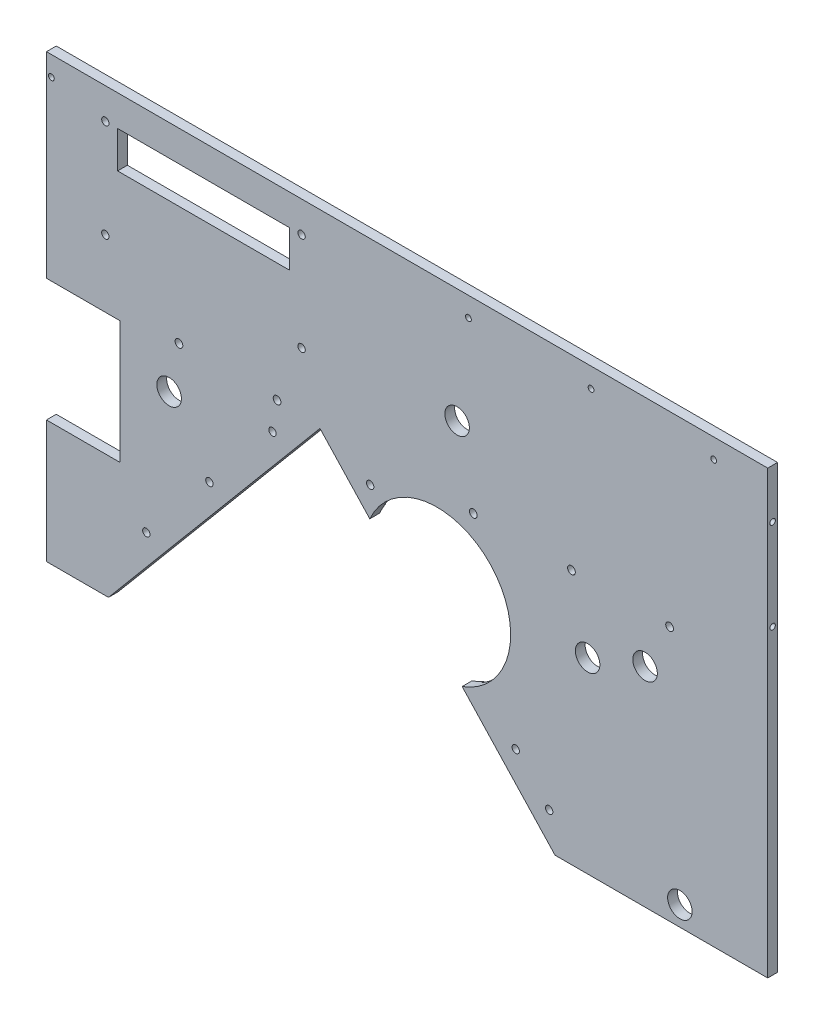
from build123d import *

# Parameters (mm, degrees)
BOSS_EXTRUDE1_DEPTH = 5.08
CUT_EXTRUDE2_DEPTH  = 1.27
SKETCH5_W           = 38.1
SKETCH5_H           = 63.5
CUT_EXTRUDE3_DEPTH  = 7.62
SKETCH6_R           = 1.905
CUT_EXTRUDE4_DEPTH  = 7.62
SKETCH7_R           = 38.1
CUT_EXTRUDE5_DEPTH  = 7.62
SKETCH8_R           = 1.905
SKETCH8_W           = 88.9
SKETCH8_H           = 19.05
CUT_EXTRUDE6_DEPTH  = 7.62
SKETCH9_R           = 6.35
CUT_EXTRUDE7_DEPTH  = 7.62
SKETCH10_R          = 6.35
CUT_EXTRUDE8_DEPTH  = 7.62
SKETCH11_R          = 1.5
CUT_EXTRUDE9_DEPTH  = 25.4
SKETCH12_R          = 2
CUT_EXTRUDE10_DEPTH = 381
SKETCH13_R          = 1.4224
CUT_EXTRUDE11_DEPTH = 12.7


with BuildPart() as part:
    # Sketch2 → Boss-Extrude1 (new body)
    with BuildSketch(Plane.XY):
        Polygon((0, 0), (32.101676515, 0), (141.594783791, 130.488803961), (263.277562057, 0), (373.38, 0), (373.38, 228.6), (0, 228.6), align=None)
    extrude(amount=BOSS_EXTRUDE1_DEPTH)

    # Sketch4 → Cut-Extrude2 (cut)
    with BuildSketch(Plane(origin=(0, 0, 0), x_dir=(-1, 0, 0), z_dir=(0, 0, -1))):
        Polygon((-283.710082919, 0), (-271.867141325, 0), (-141.594783791, 139.7), (-24.372565316, 0), (-13.716, 0), (-141.594783791, 152.4), align=None)
    extrude(amount=-CUT_EXTRUDE2_DEPTH, mode=Mode.SUBTRACT)

    # Sketch5 → Cut-Extrude3 (cut)
    with BuildSketch(Plane.XY.offset(5.08)):
        with Locations((19.05, 95.25)):
            Rectangle(SKETCH5_W, SKETCH5_H)
    extrude(amount=-CUT_EXTRUDE3_DEPTH, mode=Mode.SUBTRACT)

    # Sketch6 → Cut-Extrude4 (cut)
    with BuildSketch(Plane(origin=(0, 0, 1.27), x_dir=(-1, 0, 0), z_dir=(0, 0, -1))):
        with Locations((-51.69789323, 38.91505771)):
            Circle(SKETCH6_R)
        with Locations((-84.351503802, 77.830115421)):
            Circle(SKETCH6_R)
        with Locations((-117.005114374, 116.745173131)):
            Circle(SKETCH6_R)
        with Locations((-167.57892131, 118.185423968)):
            Circle(SKETCH6_R)
        with Locations((-242.932920113, 37.378153476)):
            Circle(SKETCH6_R)
        with Locations((-260.255678459, 18.801769455)):
            Circle(SKETCH6_R)
    extrude(amount=-CUT_EXTRUDE4_DEPTH, mode=Mode.SUBTRACT)

    # Sketch7 → Cut-Extrude5 (cut)
    with BuildSketch(Plane(origin=(0, 0, 0), x_dir=(-1, 0, 0), z_dir=(0, 0, -1))):
        with Locations((-202.206417984, 87.401980028)):
            Circle(SKETCH7_R)
    extrude(amount=-CUT_EXTRUDE5_DEPTH, mode=Mode.SUBTRACT)

    # Sketch8 → Cut-Extrude6 (cut)
    with BuildSketch(Plane(origin=(0, 0, 0), x_dir=(-1, 0, 0), z_dir=(0, 0, -1))):
        with Locations((-132.08, 212.598)):
            Circle(SKETCH8_R)
        with Locations((-30.48, 212.598)):
            Circle(SKETCH8_R)
        with Locations((-132.08, 161.798)):
            Circle(SKETCH8_R)
        with Locations((-30.48, 161.798)):
            Circle(SKETCH8_R)
        with Locations((-81.28, 203.073)):
            Rectangle(SKETCH8_W, SKETCH8_H)
    extrude(amount=-CUT_EXTRUDE6_DEPTH, mode=Mode.SUBTRACT)

    # Sketch9 → Cut-Extrude7 (cut)
    with BuildSketch(Plane(origin=(0, 0, 0), x_dir=(-1, 0, 0), z_dir=(0, 0, -1))):
        with Locations((-327.914, 10.16)):
            Circle(SKETCH9_R)
        with Locations((-280.139109994, 96.938127918)):
            Circle(SKETCH9_R)
        with Locations((-212.580352446, 169.3860256)):
            Circle(SKETCH9_R)
    extrude(amount=-CUT_EXTRUDE7_DEPTH, mode=Mode.SUBTRACT)

    # Sketch10 → Cut-Extrude8 (cut)
    with BuildSketch(Plane(origin=(0, 0, 0), x_dir=(-1, 0, 0), z_dir=(0, 0, -1))):
        with Locations((-309.88, 107.95)):
            Circle(SKETCH10_R)
        with Locations((-63.5, 107.95)):
            Circle(SKETCH10_R)
    extrude(amount=-CUT_EXTRUDE8_DEPTH, mode=Mode.SUBTRACT)

    # Sketch11 → Cut-Extrude9 (cut)
    with BuildSketch(Plane(origin=(0, 0, 0), x_dir=(-1, 0, 0), z_dir=(0, 0, -1))):
        with Locations((-345.44, 218.44)):
            Circle(SKETCH11_R)
        with Locations((-281.94, 218.44)):
            Circle(SKETCH11_R)
        with Locations((-218.44, 218.44)):
            Circle(SKETCH11_R)
        with Locations((-2.54, 218.44)):
            Circle(SKETCH11_R)
    extrude(amount=-CUT_EXTRUDE9_DEPTH, mode=Mode.SUBTRACT)

    # Sketch12 → Cut-Extrude10 (cut)
    with BuildSketch(Plane.XY.offset(5.08)):
        with Locations((322.58, 132.08)):
            Circle(SKETCH12_R)
        with Locations((271.78, 132.08)):
            Circle(SKETCH12_R)
        with Locations((220.98, 132.08)):
            Circle(SKETCH12_R)
        with Locations((119.38, 132.08)):
            Circle(SKETCH12_R)
        with Locations((68.58, 132.08)):
            Circle(SKETCH12_R)
    extrude(amount=-CUT_EXTRUDE10_DEPTH, mode=Mode.SUBTRACT)

    # Sketch13 → Cut-Extrude11 (cut)
    with BuildSketch(Plane(origin=(373.38, 0, 0), x_dir=(0, 0, -1), z_dir=(1, 0, 0))):
        with Locations((-2.54, 203.2)):
            Circle(SKETCH13_R)
        with Locations((-2.54, 156.21)):
            Circle(SKETCH13_R)
    extrude(amount=-CUT_EXTRUDE11_DEPTH, mode=Mode.SUBTRACT)


solid = part.part
